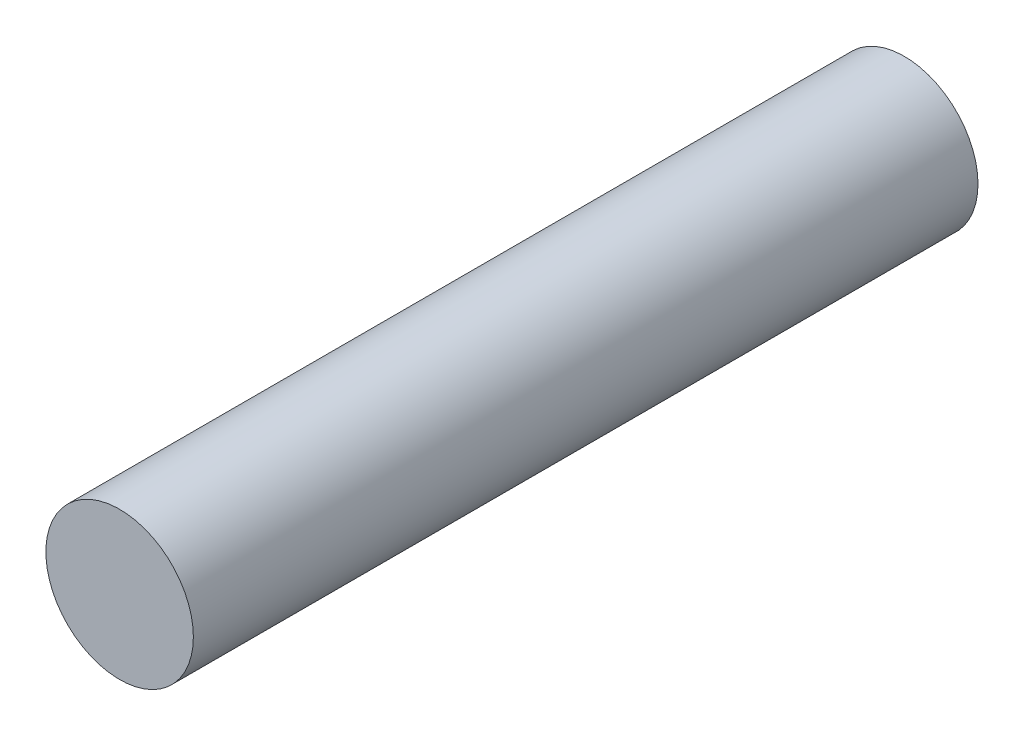
from build123d import *

# Parameters (mm, degrees)
ESQUISSE1_R        = 2.35
BOSS_EXTRU_1_DEPTH = 25


with BuildPart() as part:
    # Esquisse1 → Boss.-Extru.1 (new body)
    with BuildSketch(Plane.XY):
        with Locations((-3.481616006, 1.206416009)):
            Circle(ESQUISSE1_R)
    extrude(amount=BOSS_EXTRU_1_DEPTH)


solid = part.part
